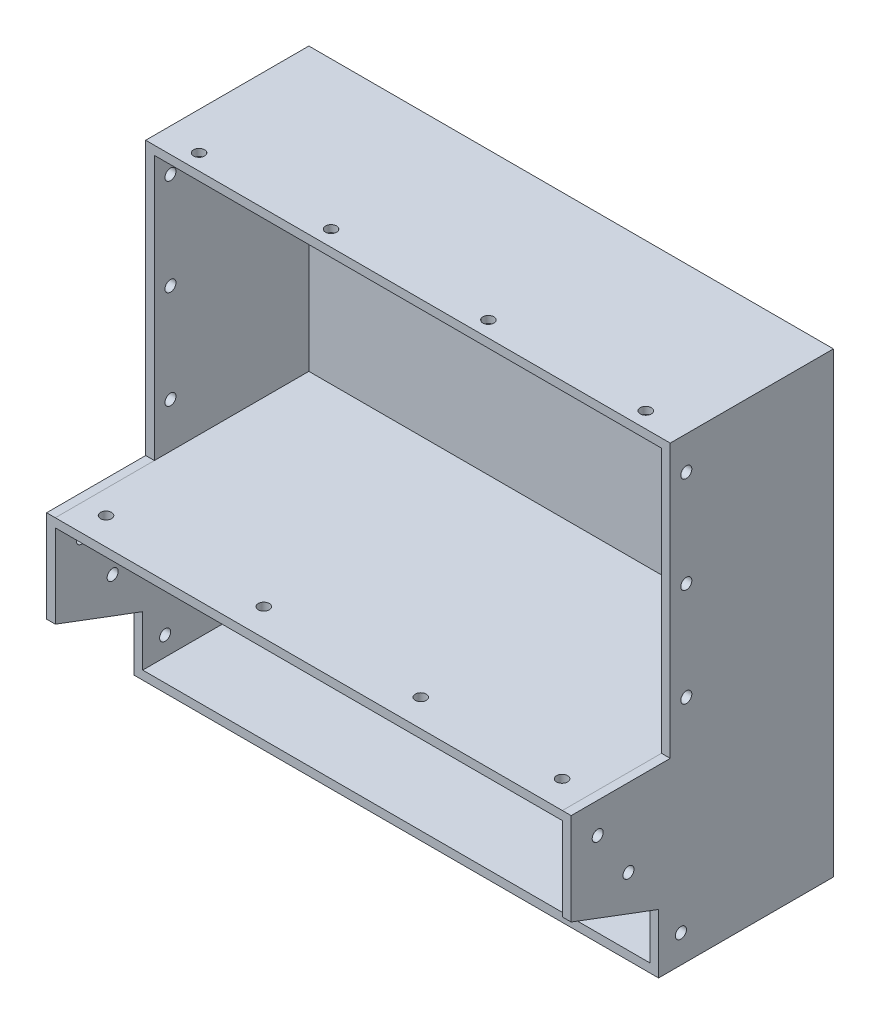
from build123d import *

# Parameters (mm, degrees)
SKETCH1_W           = 190.5
SKETCH1_H           = 166.116
BOSS_EXTRUDE1_DEPTH = 95.25
CUT_EXTRUDE1_DEPTH  = 92.075
CUT_EXTRUDE5_DEPTH  = 35.98418
SKETCH17_W          = 190.5
SKETCH17_H          = 33.474363619
CUT_EXTRUDE6_DEPTH  = 31.75
BOSS_EXTRUDE8_DEPTH = 190.5
SKETCH19_W          = 184.15
SKETCH19_H          = 30.313503047
CUT_EXTRUDE7_DEPTH  = 92.075
SKETCH20_W          = 184.15
SKETCH20_H          = 33.914711244
CUT_EXTRUDE8_DEPTH  = 13.175
CUT_EXTRUDE9_DEPTH  = 60.325
SKETCH23_R          = 2.00000108
CUT_EXTRUDE10_DEPTH = 2.54
SKETCH24_R          = 2
SKETCH24_R_2        = 2.00000108
CUT_EXTRUDE11_DEPTH = 2.54
SKETCH25_R          = 2.00000108
CUT_EXTRUDE12_DEPTH = 229.607619873
SKETCH27_R          = 2.00000108
CUT_EXTRUDE13_DEPTH = 3.175
SKETCH28_R          = 2.00000108
CUT_EXTRUDE15_DEPTH = 229.607619873


with BuildPart() as part:
    # Sketch1 → Boss-Extrude1 (new body)
    with BuildSketch(Plane.XY):
        Rectangle(SKETCH1_W, SKETCH1_H)
    extrude(amount=BOSS_EXTRUDE1_DEPTH)

    # Sketch3 → Cut-Extrude1 (cut)
    with BuildSketch(Plane.XY.offset(95.25)):
        Polygon((-92.075, 79.883), (-92.075, 32.891702926), (-92.075, -16.095133334), (92.075, -16.095133334), (92.075, 48.662739539), (92.075, 79.883), (83.88326961, 79.883), (-81.085829842, 79.883), align=None)
    extrude(amount=-CUT_EXTRUDE1_DEPTH, mode=Mode.SUBTRACT)

    # Sketch15 → Cut-Extrude5 (cut)
    with BuildSketch(Plane.XY.offset(95.25)):
        Polygon((95.25, -16.109272762), (95.25, 83.058), (-95.25, 83.058), (-95.25, -16.109272762), (-92.075, -16.095133334), (-92.075, 79.883), (92.075, 79.883), (92.075, -16.095133334), align=None)
    extrude(amount=-CUT_EXTRUDE5_DEPTH, mode=Mode.SUBTRACT)

    # Sketch17 → Cut-Extrude6 (cut)
    with BuildSketch(Plane.XY.offset(95.25)):
        with Locations((0, -66.320818191)):
            Rectangle(SKETCH17_W, SKETCH17_H)
    extrude(amount=-CUT_EXTRUDE6_DEPTH, mode=Mode.SUBTRACT)

    # Sketch18 → Boss-Extrude8 (add)
    with BuildSketch(Plane.ZY.offset(95.25)):
        Polygon((63.5, -49.583636381), (63.5, -61.506100001), (95.25, -49.583636381), align=None)
    extrude(amount=-BOSS_EXTRUDE8_DEPTH)

    # Sketch19 → Cut-Extrude7 (cut)
    with BuildSketch(Plane.XY.offset(95.25)):
        with Locations((0, -34.426884857)):
            Rectangle(SKETCH19_W, SKETCH19_H)
    extrude(amount=-CUT_EXTRUDE7_DEPTH, mode=Mode.SUBTRACT)

    # Sketch20 → Cut-Extrude8 (cut)
    with BuildSketch(Plane(origin=(0, -74.803163357, 28.08938563), x_dir=(1, 0, 0), z_dir=(0, -0.9361719099317519, 0.3515425366221503))):
        with Locations((0, 54.782261491)):
            Rectangle(SKETCH20_W, SKETCH20_H)
    extrude(amount=-CUT_EXTRUDE8_DEPTH, mode=Mode.SUBTRACT)

    # Sketch21 → Cut-Extrude9 (cut)
    with BuildSketch(Plane.XY.offset(63.5)):
        Polygon((-92.075, -61.506100001), (-92.075, -49.583636381), (92.075, -49.583636381), (92.075, -61.506100001), (92.075, -79.883), (-92.075, -79.883), align=None)
    extrude(amount=-CUT_EXTRUDE9_DEPTH, mode=Mode.SUBTRACT)

    # Sketch23 → Cut-Extrude10 (cut)
    with BuildSketch(Plane.XZ.offset(83.058)):
        with Locations(Location((-83.319719804, 53.848, 0), (0, 0, 270))):
            Circle(SKETCH23_R)
        with Locations(Location((-26.423719804, 53.848, 0), (0, 0, 270))):
            Circle(SKETCH23_R)
        with Locations(Location((30.472280196, 53.848, 0), (0, 0, 270))):
            Circle(SKETCH23_R)
        with Locations(Location((82.288280196, 53.848, 0), (0, 0, 270))):
            Circle(SKETCH23_R)
    extrude(amount=-CUT_EXTRUDE10_DEPTH, mode=Mode.SUBTRACT)

    # Sketch24 → Cut-Extrude11 (cut)
    with BuildSketch(Plane(origin=(0, 83.058, 0), x_dir=(1, 0, 0), z_dir=(0, 1, 0))):
        with Locations(Location((80.65616897, -53.55082, 0), (0, 0, 270))):
            Circle(SKETCH24_R)
        with Locations(Location((23.50616897, -53.55082, 0), (0, 0, 270))):
            Circle(SKETCH24_R_2)
        with Locations(Location((-33.64383103, -53.55082, 0), (0, 0, 270))):
            Circle(SKETCH24_R_2)
        with Locations(Location((-81.568772043, -53.55082, 0), (0, 0, 270))):
            Circle(SKETCH24_R_2)
    extrude(amount=-CUT_EXTRUDE11_DEPTH, mode=Mode.SUBTRACT)

    # Sketch25 → Cut-Extrude12 (cut, through all)
    with BuildSketch(Plane(origin=(95.25, 0, 0), x_dir=(0, 0, -1), z_dir=(1, 0, 0))):
        with Locations((-53.42382, 70.993)):
            Circle(SKETCH25_R)
        with Locations((-53.42382, 35.941)):
            Circle(SKETCH25_R)
        with Locations((-53.42382, 0.217760577)):
            Circle(SKETCH25_R)
    extrude(amount=-CUT_EXTRUDE12_DEPTH, mode=Mode.SUBTRACT)

    # Sketch27 → Cut-Extrude13 (cut)
    with BuildSketch(Plane(origin=(0, -16.095133334, 0), x_dir=(1, 0, 0), z_dir=(0, 1, 0))):
        with Locations(Location((82.042, -85.344, 0), (0, 0, 270))):
            Circle(SKETCH27_R)
        with Locations(Location((30.734, -85.344, 0), (0, 0, 270))):
            Circle(SKETCH27_R)
        with Locations(Location((-26.268567804, -85.344, 0), (0, 0, 270))):
            Circle(SKETCH27_R)
        with Locations(Location((-83.566, -85.344, 0), (0, 0, 270))):
            Circle(SKETCH27_R)
    extrude(amount=-CUT_EXTRUDE13_DEPTH, mode=Mode.SUBTRACT)

    # Sketch28 → Cut-Extrude15 (cut, through all)
    with BuildSketch(Plane(origin=(95.25, 0, 0), x_dir=(0, 0, -1), z_dir=(1, 0, 0))):
        with Locations((-55.372, -72.898)):
            Circle(SKETCH28_R)
        with Locations((-74.422, -44.381878841)):
            Circle(SKETCH28_R)
        with Locations((-85.598, -27.204003713)):
            Circle(SKETCH28_R)
    extrude(amount=-CUT_EXTRUDE15_DEPTH, mode=Mode.SUBTRACT)


solid = part.part
